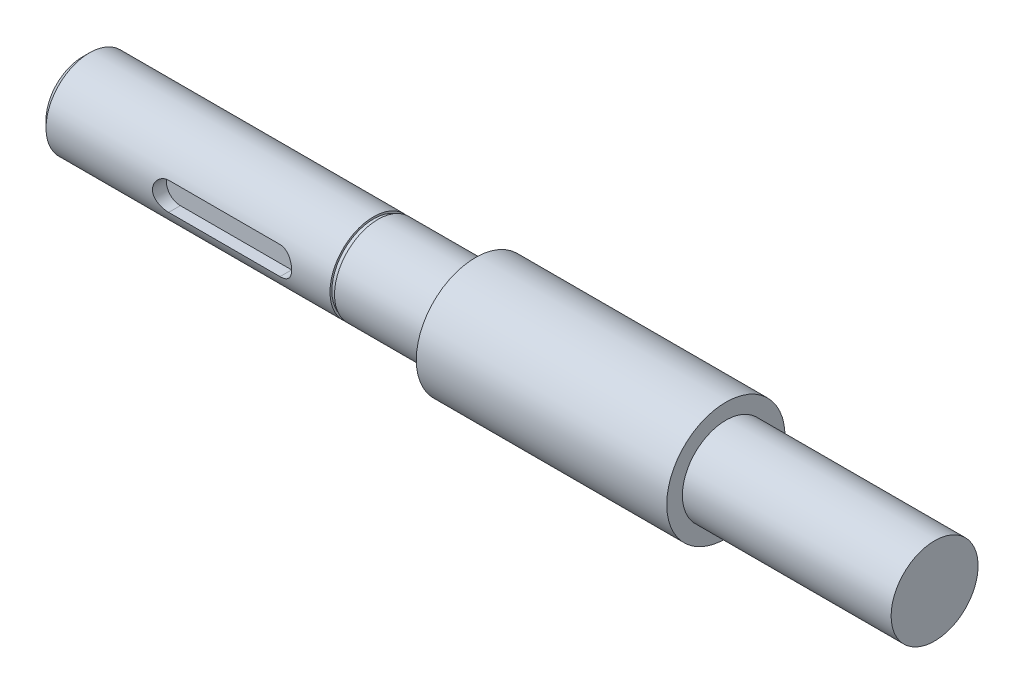
from build123d import *

# Parameters (mm, degrees)
IZIM2_W               = 1.3
IZIM2_H               = 1.828643919
KES_EKSTR_ZYON1_START = 8.5
KES_EKSTR_ZYON1_DEPTH = 10
KES_EKSTR_ZYON2_START = -18.5
KES_EKSTR_ZYON2_DEPTH = 10


with BuildPart() as part:
    # Çizim1 → Döndür1 (revolve)
    with BuildSketch(Plane.XY):
        Polygon((0, 0), (-61, 0), (-61, 10.5), (-59, 12.5), (1.944879757, 12.5), (51.944879757, 12.5), (51.944879757, 17), (123.944879757, 17), (123.944879757, 12.5), (183.944879757, 12.5), (183.944879757, 0), (123.944879757, 0), align=None)
    revolve(axis=Axis((0, 0, 0), (1, 0, 0)))

    # Çizim2 → Kes-Döndür1 (revolve, cut)
    with BuildSketch(Plane(origin=(0, 0, 0), x_dir=(1, 0, 0), z_dir=(0, 1, 0))):
        with Locations((23.29, -12.864321959)):
            Rectangle(IZIM2_W, IZIM2_H)
    revolve(axis=Axis((0, 0, 0), (1, 0, 0)), mode=Mode.SUBTRACT)

    # Çizim3 → Kes-Ekstrüzyon1 (cut)
    with BuildSketch(Plane.XY.offset(KES_EKSTR_ZYON1_START)):
        with BuildLine():
            Line((-24.391699554, 4), (7.608300446, 4))
            ThreePointArc((7.608300446, 4), (11.608300446, 0), (7.608300446, -4))
            Line((7.608300446, -4), (-24.391699554, -4))
            ThreePointArc((-24.391699554, -4), (-28.391699554, 0), (-24.391699554, 4))
        make_face()
    extrude(amount=KES_EKSTR_ZYON1_DEPTH, mode=Mode.SUBTRACT)

    # Çizim3<2> → Kes-Ekstrüzyon2 (cut)
    with BuildSketch(Plane.XY.offset(KES_EKSTR_ZYON2_START)):
        with BuildLine():
            Line((-24.391699554, 4), (7.608300446, 4))
            ThreePointArc((7.608300446, 4), (11.608300446, 0), (7.608300446, -4))
            Line((7.608300446, -4), (-24.391699554, -4))
            ThreePointArc((-24.391699554, -4), (-28.391699554, 0), (-24.391699554, 4))
        make_face()
    extrude(amount=KES_EKSTR_ZYON2_DEPTH, mode=Mode.SUBTRACT)


solid = part.part
